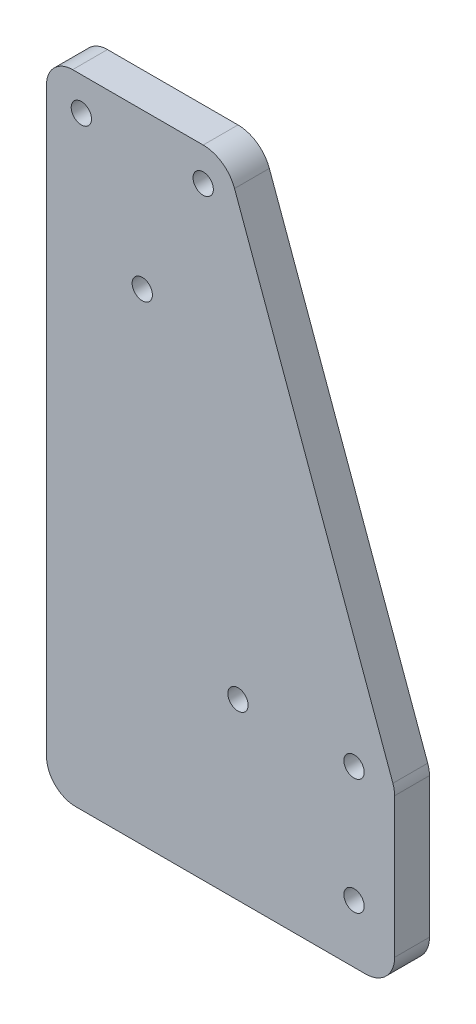
from build123d import *

# Parameters (mm, degrees)
ESBO_O1_W                = 60
ESBO_O1_H                = 110
ESBO_O1_R                = 1.75
RESSALTO_EXTRUS_O1_DEPTH = 6
ESBO_O2_R                = 1.75
CORTE_EXTRUS_O1_DEPTH    = 63.93647591
CORTE_EXTRUS_O3_DEPTH    = 63.93647591
FILETE1_R                = 5


with BuildPart() as part:
    # Esboço1 → Ressalto-extrusão1 (new body)
    with BuildSketch(Plane.XY):
        Rectangle(ESBO_O1_W, ESBO_O1_H)
        with Locations((23, -45)):
            Circle(ESBO_O1_R, mode=Mode.SUBTRACT)
        with Locations((23, -25)):
            Circle(ESBO_O1_R, mode=Mode.SUBTRACT)
        with Locations((3, -25)):
            Circle(ESBO_O1_R, mode=Mode.SUBTRACT)
    extrude(amount=RESSALTO_EXTRUS_O1_DEPTH)

    # Esboço2 → Corte-extrusão1 (cut, through all)
    with BuildSketch(Plane.XY.offset(6)):
        with Locations((-24, 49)):
            Circle(ESBO_O2_R)
        with Locations(Location((-3, 49, 0), (0, 0, 180))):
            Circle(ESBO_O2_R)
        with Locations((-13.5, 28)):
            Circle(ESBO_O2_R)
    extrude(amount=-CORTE_EXTRUS_O1_DEPTH, mode=Mode.SUBTRACT)

    # Esboço4 → Corte-extrusão3 (cut, through all)
    with BuildSketch(Plane(origin=(0, 0, 0), x_dir=(-1, 0, 0), z_dir=(0, 0, -1))):
        with BuildLine():
            Line((3, 54.75), (25.5, 54.75))
            ThreePointArc((25.5, 54.75), (28.681980515, 53.431980515), (30, 50.25))
            Line((30, 50.25), (30, 18.54785582))
            Line((30, 18.54785582), (51.213466558, 18.54785582))
            Line((51.213466558, 18.54785582), (51.213466558, 63.658711058))
            Line((51.213466558, 63.658711058), (-45.570141277, 63.658711058))
            Line((-45.570141277, 63.658711058), (-45.570141277, -25))
            Line((-45.570141277, -25), (-30, -25))
            Line((-30, -25), (-2.404439279, 50.963297246))
            ThreePointArc((-2.404439279, 50.963297246), (-0.299510633, 53.709111337), (3, 54.75))
        make_face()
    extrude(amount=-CORTE_EXTRUS_O3_DEPTH, mode=Mode.SUBTRACT)

    # Filete1
    filete1_edges = [part.edges().sort_by_distance(p)[0] for p in [
        (30, -25, 3),
        (30, -55, 3),
        (-30, -55, 3),
    ]]
    fillet(filete1_edges, radius=FILETE1_R)


solid = part.part
